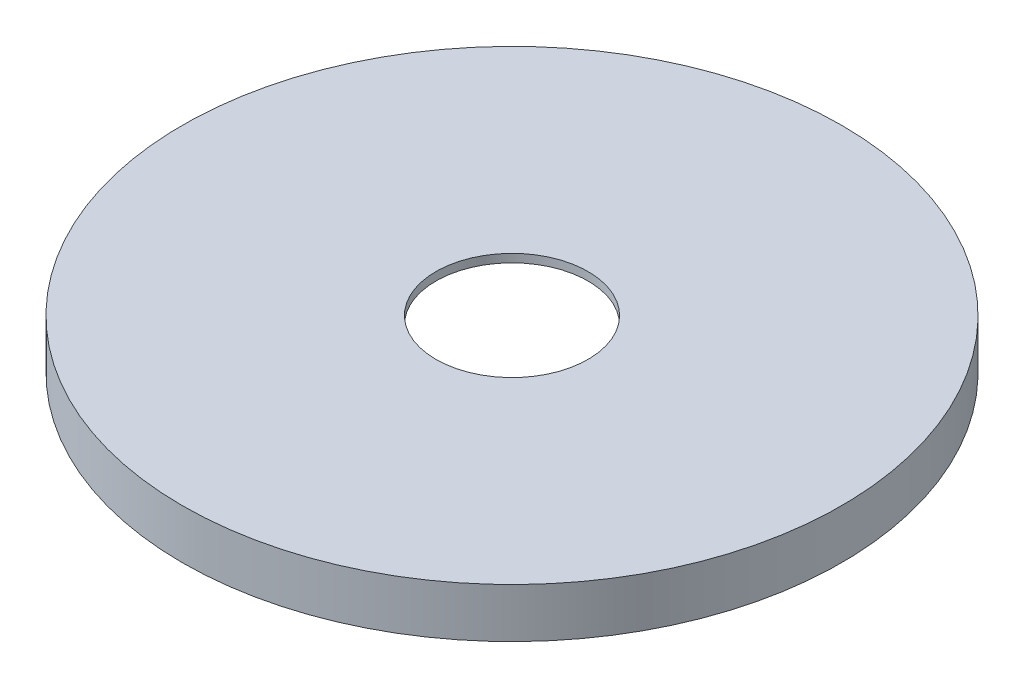
from build123d import *

# Parameters (mm, degrees)
SKETCH2_R          = 9.236617416
CUT_EXTRUDE1_DEPTH = 1


with BuildPart() as part:
    # Sketch1 → Revolve-Thin1 (revolve)
    with BuildSketch(Plane(origin=(-3.343067137, -71.829408913, 16.911722701), x_dir=(1, 0, 0), z_dir=(0, 0, 1)), mode=Mode.PRIVATE) as revolve_thin1_sk:
        Polygon((-36.656932863, 65.829408913), (-36.656932863, 71.829408913), (3.343067137, 71.829408913), (3.343067137, 70.829408913), (-35.656932863, 70.829408913), (-35.656932863, 65.829408913), align=None)
    revolve(revolve_thin1_sk.sketch.rotate(Axis((0, 0, 16.911722701), (0, 1, 0)), 270), axis=Axis((0, 0, 16.911722701), (0, 1, 0)))

    # Sketch2 → Cut-Extrude1 (cut)
    with BuildSketch(Plane(origin=(0, 0, 0), x_dir=(1, 0, 0), z_dir=(0, 1, 0))):
        with Locations(Location((0, -16.911722701, 0), (0, 0, 270))):
            Circle(SKETCH2_R)
    extrude(amount=-CUT_EXTRUDE1_DEPTH, mode=Mode.SUBTRACT)


solid = part.part
